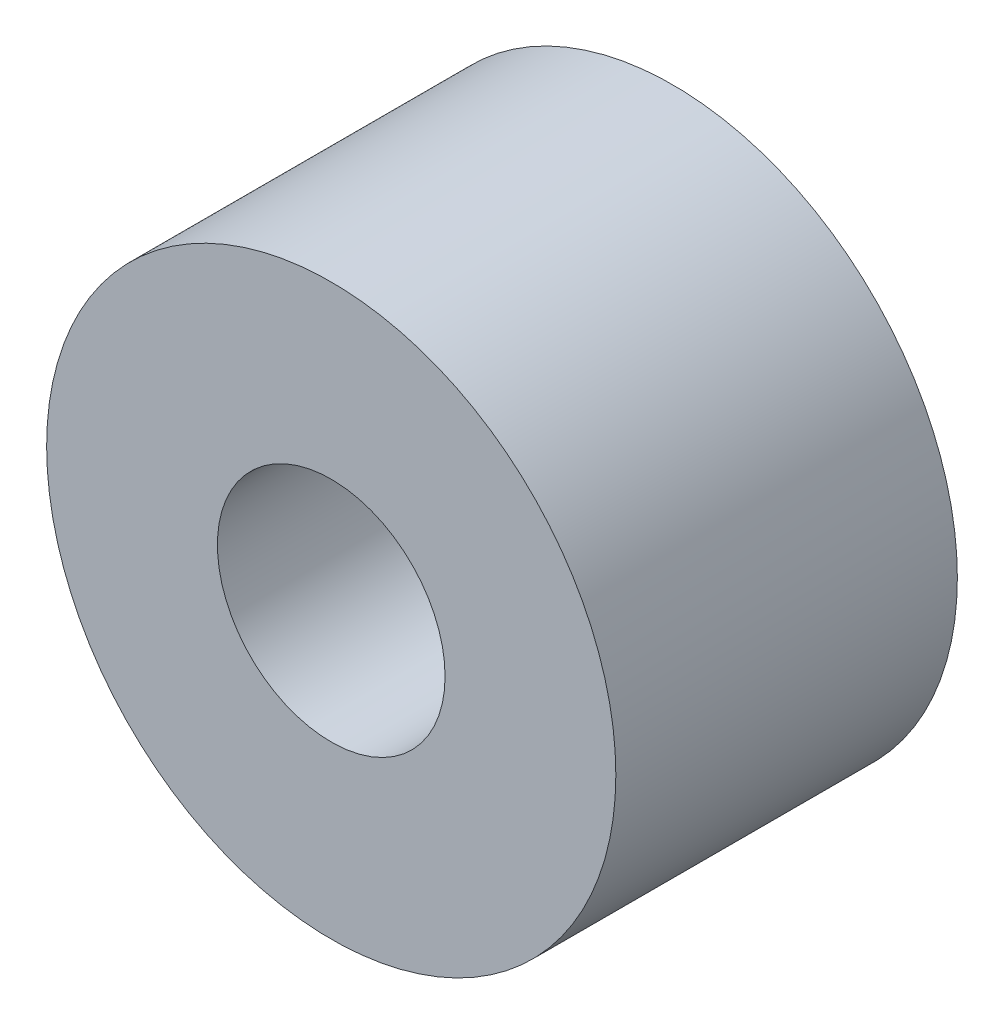
from build123d import *

# Parameters (mm, degrees)
SKETCH1_R           = 5
BOSS_EXTRUDE1_DEPTH = 6
SKETCH2_R           = 2
CUT_EXTRUDE1_DEPTH  = 6


with BuildPart() as part:
    # Sketch1 → Boss-Extrude1 (new body)
    with BuildSketch(Plane.XY):
        Circle(SKETCH1_R)
    extrude(amount=BOSS_EXTRUDE1_DEPTH)

    # Sketch2 → Cut-Extrude1 (cut)
    with BuildSketch(Plane.XY.offset(6)):
        Circle(SKETCH2_R)
    extrude(amount=-CUT_EXTRUDE1_DEPTH, mode=Mode.SUBTRACT)


solid = part.part
